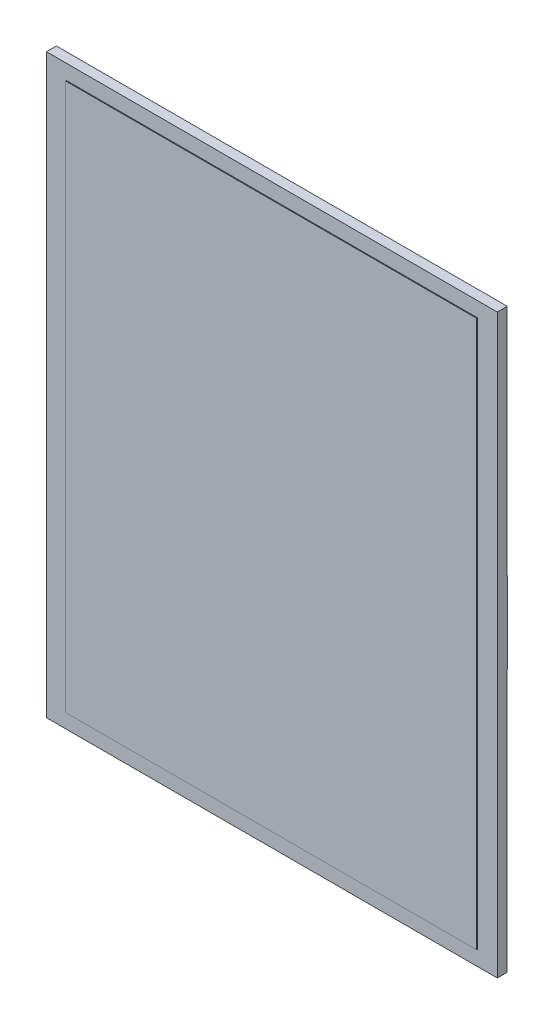
from build123d import *

# Parameters (mm, degrees)
SKETCH1_W           = 136
SKETCH1_H           = 174
BOSS_EXTRUDE1_DEPTH = 3
SKETCH2_W           = 124
SKETCH2_H           = 165
BOSS_EXTRUDE2_DEPTH = 0.25
SKETCH3_W           = 18.155382523
SKETCH3_H           = 24.50047974
BOSS_EXTRUDE3_DEPTH = 0.1


with BuildPart() as part:
    # Sketch1 → Boss-Extrude1 (new body)
    with BuildSketch(Plane.XY):
        Rectangle(SKETCH1_W, SKETCH1_H)
    extrude(amount=BOSS_EXTRUDE1_DEPTH)

    # Sketch2 → Boss-Extrude2 (add)
    with BuildSketch(Plane.XY.offset(3)):
        Rectangle(SKETCH2_W, SKETCH2_H)
    extrude(amount=BOSS_EXTRUDE2_DEPTH)

    # Sketch3 → Boss-Extrude3 (add)
    with BuildSketch(Plane(origin=(0, 0, 0), x_dir=(-1, 0, 0), z_dir=(0, 0, -1))):
        with Locations((-58.922308738, 4.333016158)):
            Rectangle(SKETCH3_W, SKETCH3_H)
    extrude(amount=BOSS_EXTRUDE3_DEPTH)


solid = part.part
